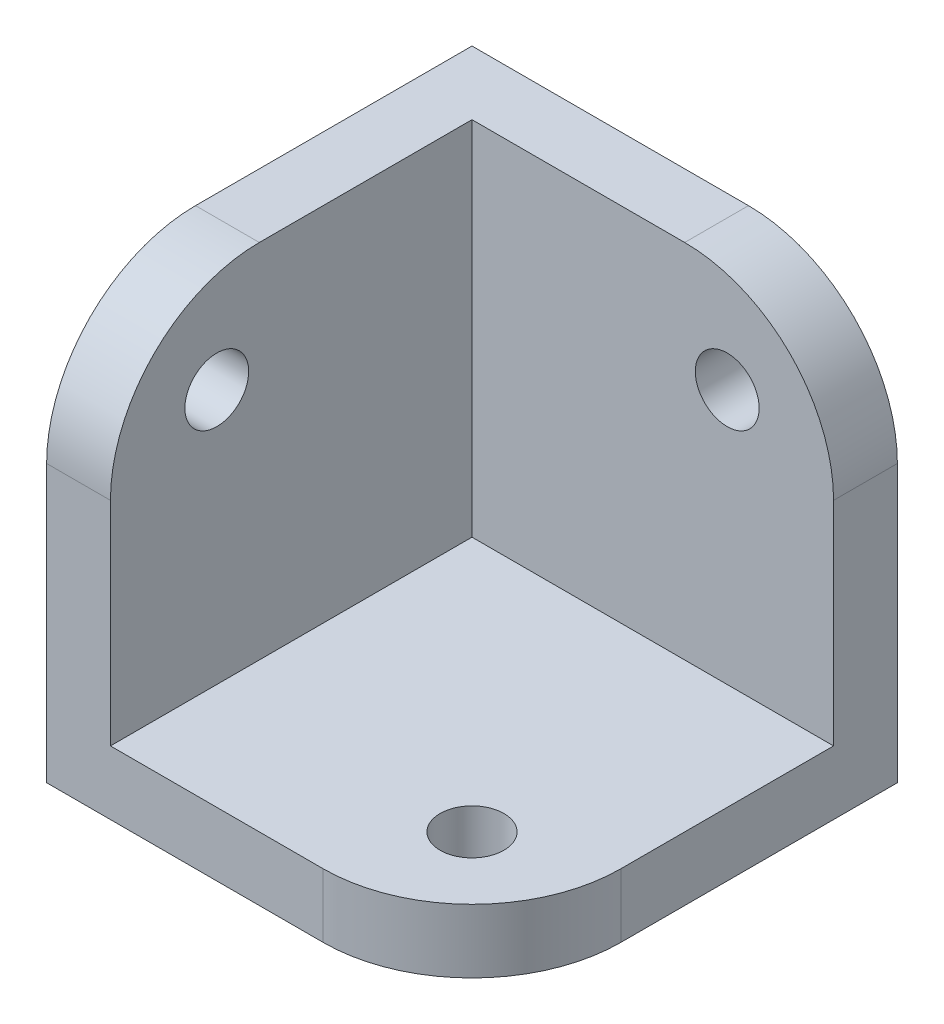
from build123d import *

# Parameters (mm, degrees)
SKETCH1_W           = 20
SKETCH1_H           = 20
BOSS_EXTRUDE1_DEPTH = 3
BOSS_EXTRUDE2_DEPTH = 17
SKETCH3_R           = 1.5
CUT_EXTRUDE1_DEPTH  = 17
SKETCH4_R           = 1.5
CUT_EXTRUDE2_DEPTH  = 17
SKETCH5_R           = 1.5
CUT_EXTRUDE3_DEPTH  = 17
FILLET1_R           = 7


with BuildPart() as part:
    # Sketch1 → Boss-Extrude1 (new body)
    with BuildSketch(Plane.XY):
        with Locations((10, 10)):
            Rectangle(SKETCH1_W, SKETCH1_H)
    extrude(amount=BOSS_EXTRUDE1_DEPTH)

    # Sketch2 → Boss-Extrude2 (add)
    with BuildSketch(Plane.XY.offset(3)):
        Polygon((0, 20), (3, 20), (3, 3), (20, 3), (20, 0), (0, 0), align=None)
    extrude(amount=BOSS_EXTRUDE2_DEPTH)

    # Sketch3 → Cut-Extrude1 (cut)
    with BuildSketch(Plane.ZY):
        with Locations((15, 15)):
            Circle(SKETCH3_R)
    extrude(amount=-CUT_EXTRUDE1_DEPTH, mode=Mode.SUBTRACT)

    # Sketch4 → Cut-Extrude2 (cut)
    with BuildSketch(Plane(origin=(0, 0, 0), x_dir=(-1, 0, 0), z_dir=(0, 0, -1))):
        with Locations((-15, 15)):
            Circle(SKETCH4_R)
    extrude(amount=-CUT_EXTRUDE2_DEPTH, mode=Mode.SUBTRACT)

    # Sketch5 → Cut-Extrude3 (cut)
    with BuildSketch(Plane(origin=(0, 0, 0), x_dir=(-1, 0, 0), z_dir=(0, -1, 0))):
        with Locations(Location((-15, -15, 0), (0, 0, 90))):
            Circle(SKETCH5_R)
    extrude(amount=-CUT_EXTRUDE3_DEPTH, mode=Mode.SUBTRACT)

    # Fillet1
    fillet1_edges = [part.edges().sort_by_distance(p)[0] for p in [
        (20, 1.5, 20),
        (1.5, 20, 20),
        (20, 20, 1.5),
    ]]
    fillet(fillet1_edges, radius=FILLET1_R)


solid = part.part
